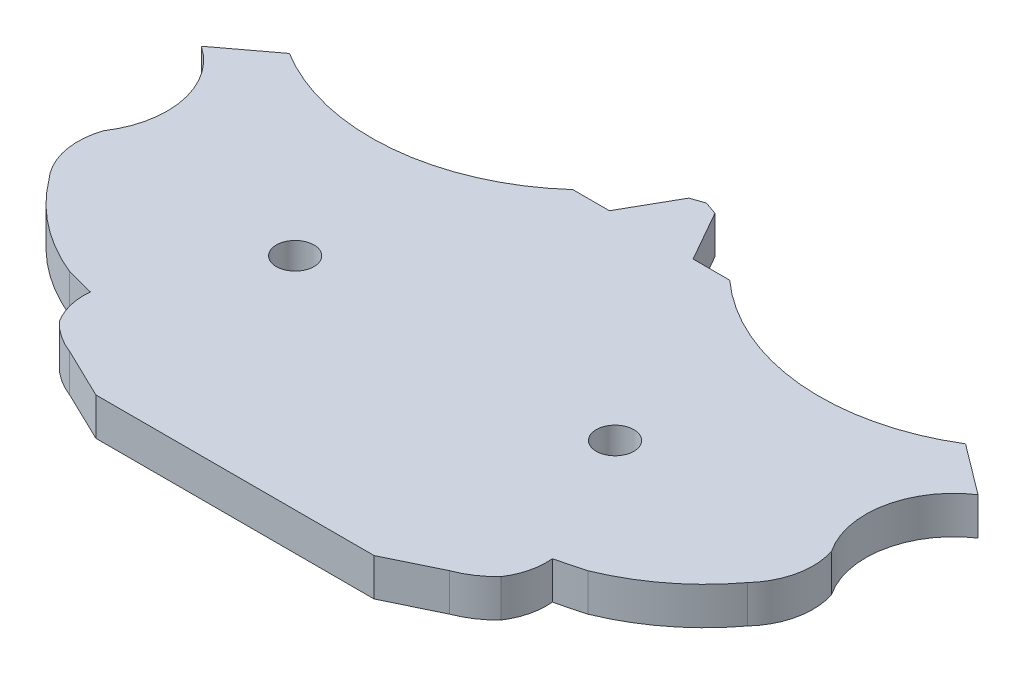
from build123d import *

# Parameters (mm, degrees)
SKETCH2_R           = 1
BOSS_EXTRUDE1_DEPTH = 2
SCALE1_SCALE        = 2


with BuildPart() as part:
    # Sketch2 → Boss-Extrude1 (new body)
    # profile 1 of 4: a face of its own
    with BuildSketch(Plane(origin=(0, 0, 0), x_dir=(1, 0, 0), z_dir=(0, 1, 0))):
        with BuildLine():
            Line((-1.534348462, -5.637537028), (1.534348462, -5.637537028))
            ThreePointArc((1.534348462, -5.637537028), (4.324823338, -6.236497301), (6.623693303, -7.927857797))
            ThreePointArc((6.623693303, -7.927857797), (10.236440266, -7.514468852), (13.78312899, -6.712078584))
            ThreePointArc((13.78312899, -6.712078584), (16.421478173, -5.190969631), (18.558961711, -3.021678736))
            ThreePointArc((18.558961711, -3.021678736), (19.45411943, -1.286546543), (19.346117765, 0.662896123))
            ThreePointArc((19.346117765, 0.662896123), (18.649238809, 4.17439457), (20.639475337, 7.15016677))
            Line((20.639475337, 7.15016677), (17.967387551, 9.159795774))
            ThreePointArc((17.967387551, 9.159795774), (10.858325227, 7.499674132), (4.169484372, 10.424426945))
            Line((4.169484372, 10.424426945), (-4.169484372, 10.424426945))
            ThreePointArc((-4.169484372, 10.424426945), (-10.858325227, 7.499674132), (-17.967387551, 9.159795774))
            Line((-17.967387551, 9.159795774), (-20.639475337, 7.15016677))
            ThreePointArc((-20.639475337, 7.15016677), (-18.649238809, 4.17439457), (-19.346117765, 0.662896123))
            ThreePointArc((-19.346117765, 0.662896123), (-19.45411943, -1.286546543), (-18.558961711, -3.021678736))
            ThreePointArc((-18.558961711, -3.021678736), (-16.421478173, -5.190969631), (-13.78312899, -6.712078584))
            ThreePointArc((-13.78312899, -6.712078584), (-10.236440266, -7.514468852), (-6.623693303, -7.927857797))
            ThreePointArc((-6.623693303, -7.927857797), (-4.324823338, -6.236497301), (-1.534348462, -5.637537028))
        make_face()
        with Locations(Location((-8.5, 0, 0), (0, 0, 270))):
            Circle(SKETCH2_R, mode=Mode.SUBTRACT)
        with Locations(Location((8.5, 0, 0), (0, 0, 270))):
            Circle(SKETCH2_R, mode=Mode.SUBTRACT)
    # profile 2 of 4: a face of its own
    with BuildSketch(Plane(origin=(0, 0, 0), x_dir=(1, 0, 0), z_dir=(0, 1, 0))):
        Polygon((-0.696104526, 13.114793475), (-2.224138848, 10.424426945), (2.224138848, 10.424426945), (0.696104526, 13.114793475), (0, 13.358013588), align=None)
    # profile 3 of 4: a face of its own
    with BuildSketch(Plane(origin=(0, 0, 0), x_dir=(1, 0, 0), z_dir=(0, 1, 0))):
        with BuildLine():
            ThreePointArc((-12.276686285, -7.102440046), (-12.194265553, -8.245293076), (-11.737308023, -9.296052821))
            ThreePointArc((-11.737308023, -9.296052821), (-10.975506649, -9.937799505), (-10.090124565, -10.394175126))
            Line((-10.090124565, -10.394175126), (-7.391598262, -11.698651137))
            Line((-7.391598262, -11.698651137), (-0.775741109, -11.143020661))
            Line((-0.775741109, -11.143020661), (0, -10.959524643))
            Line((0, -10.959524643), (0.775741109, -11.143020661))
            Line((0.775741109, -11.143020661), (7.391598262, -11.698651137))
            Line((7.391598262, -11.698651137), (10.090124565, -10.394175126))
            ThreePointArc((10.090124565, -10.394175126), (10.975506649, -9.937799505), (11.737308023, -9.296052821))
            ThreePointArc((11.737308023, -9.296052821), (12.194265553, -8.245293076), (12.276686285, -7.102440046))
            ThreePointArc((12.276686285, -7.102440046), (9.46781094, -7.635829891), (6.623693303, -7.927857797))
            ThreePointArc((6.623693303, -7.927857797), (4.324823338, -6.236497301), (1.534348462, -5.637537028))
            Line((1.534348462, -5.637537028), (-1.534348462, -5.637537028))
            ThreePointArc((-1.534348462, -5.637537028), (-4.324823338, -6.236497301), (-6.623693303, -7.927857797))
            ThreePointArc((-6.623693303, -7.927857797), (-9.46781094, -7.635829891), (-12.276686285, -7.102440046))
        make_face()
    # profile 4 of 4: a face of its own
    with BuildSketch(Plane(origin=(0, 0, 0), x_dir=(1, 0, 0), z_dir=(0, 1, 0))):
        Polygon((-7.391598262, -11.698651137), (-0.775741109, -11.143020661), (0, -10.959524643), (0.775741109, -11.143020661), (7.391598262, -11.698651137), align=None)
    extrude(amount=BOSS_EXTRUDE1_DEPTH)


with BuildPart() as part_1:
    # Scale1: scaled about (0, 1, 0.244603094)
    add(part.part.scale(SCALE1_SCALE).moved(Location((0, -1, -0.244603094))))


solid = part_1.part
